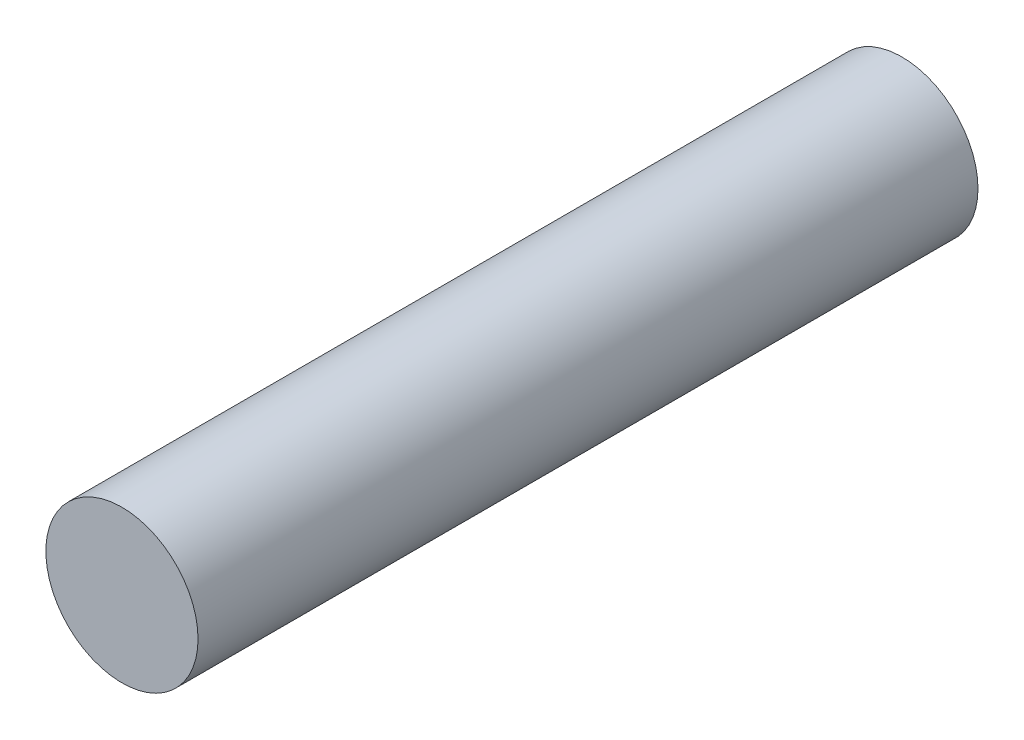
from build123d import *

# Parameters (mm, degrees)
SKETCH_1_R           = 2
CABLE_ENVELOPE_DEPTH = 20.5


with BuildPart() as part:
    # 草图1 → Cable_envelope (new body)
    with BuildSketch(Plane.XY):
        Circle(SKETCH_1_R)
    extrude(amount=CABLE_ENVELOPE_DEPTH)


solid = part.part
